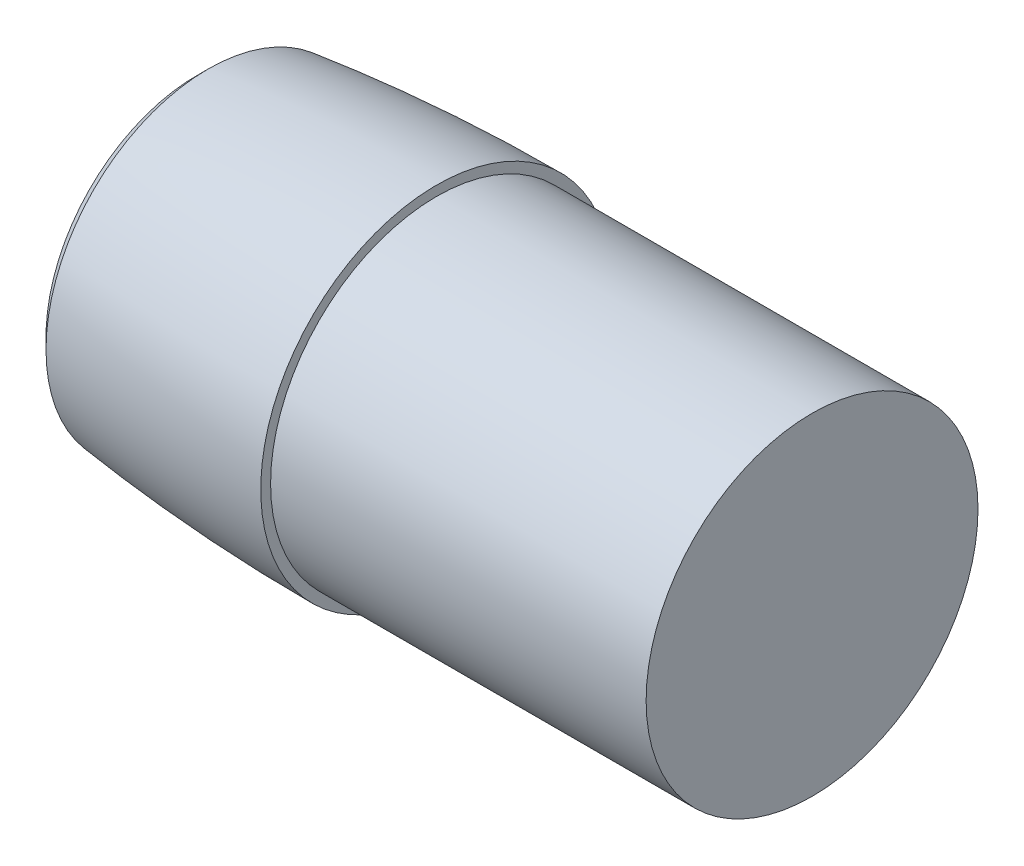
from build123d import *


with BuildPart() as part:
    # Sketch2 → Revolve1 (revolve)
    with BuildSketch(Plane.XY, mode=Mode.PRIVATE) as revolve1_sk:
        with BuildLine():
            Line((-0.061536303, 438.488079124), (-0.061536303, 436.238079124))
            Line((-0.061536303, 436.238079124), (85.938463697, 436.238079124))
            Line((85.938463697, 436.238079124), (85.938463697, 398.238079124))
            Line((85.938463697, 398.238079124), (80.938463697, 398.238079124))
            Line((80.938463697, 398.238079124), (80.938463697, 431.238079124))
            Line((80.938463697, 431.238079124), (-5.061536303, 431.238079124))
            Line((-5.061536303, 431.238079124), (-5.061536303, 436.238079124))
            ThreePointArc((-5.061536303, 436.238079124), (-30.047002163, 435.231499881), (-54.933754935, 432.795059348))
            Line((-54.933754935, 432.795059348), (-52.380594275, 435.348220008))
            ThreePointArc((-52.380594275, 435.348220008), (-26.268021313, 437.700571598), (-0.061536303, 438.488079124))
        make_face()
    revolve(revolve1_sk.sketch.rotate(Axis((-190.061536303, 398.238079124, 0), (-1, 0, 0)), 90), axis=Axis((-190.061536303, 398.238079124, 0), (-1, 0, 0)))


solid = part.part
